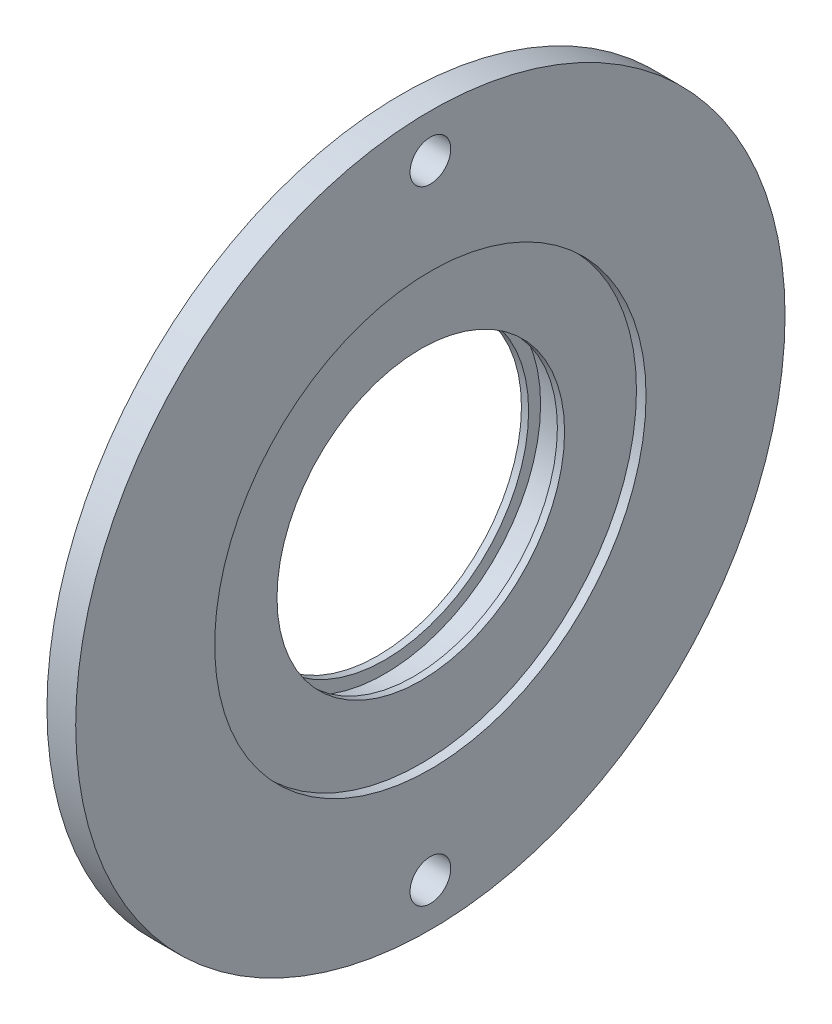
from build123d import *

# Parameters (mm, degrees)
ENL_V_MAT_EXTRU_1_DEPTH      = 211.456646367
ENL_V_MAT_EXTRU_1_DEPTH_BACK = 211.456646367
ESQUISSE2_R                  = 8.5
ESQUISSE3_R                  = 90
ENL_V_MAT_EXTRU_2_DEPTH      = 4
ENL_V_START                  = -3
ESQUISSE6_R                  = 65
ENL_V_MAT_EXTRU_5_DEPTH      = 12
ENL_V_MAT_EXTRU_6_DEPTH      = 211.456646367
ENL_V_MAT_EXTRU_6_DEPTH_BACK = 211.456646367
ESQUISSE7_R                  = 60


with BuildPart() as part:
    # Esquisse1 → Révolution1 (revolve)
    with BuildSketch(Plane.XY, mode=Mode.PRIVATE) as r_volution1_sk:
        Polygon((22, 0), (0, 0), (0, 100), (10, 100), (10, 148), (22, 148), align=None)
    revolve(r_volution1_sk.sketch.rotate(Axis((22, 0, 0), (-1, 0, 0)), 90), axis=Axis((22, 0, 0), (-1, 0, 0)))

    # Esquisse2 → Enlèv. mat.-Extru.1 (cut, two sides: drawn at the far end of the back side and taken through both)
    with BuildSketch(Plane(origin=(22, 0, 0), x_dir=(0, 0, -1), z_dir=(1, 0, 0)).offset(-ENL_V_MAT_EXTRU_1_DEPTH_BACK)):
        with Locations((0, 130)):
            Circle(ESQUISSE2_R)
        with Locations((0, -130)):
            Circle(ESQUISSE2_R)
    extrude(amount=ENL_V_MAT_EXTRU_1_DEPTH + ENL_V_MAT_EXTRU_1_DEPTH_BACK, mode=Mode.SUBTRACT)

    # Esquisse3 → Enlèv. mat.-Extru.2 (cut)
    with BuildSketch(Plane(origin=(22, 0, 0), x_dir=(0, 0, -1), z_dir=(1, 0, 0))):
        Circle(ESQUISSE3_R)
    extrude(amount=-ENL_V_MAT_EXTRU_2_DEPTH, mode=Mode.SUBTRACT)

    # Esquisse6 → Enlèv. mat.-Extru.5 (cut)
    with BuildSketch(Plane(origin=(18, 0, 0), x_dir=(0, 0, -1), z_dir=(1, 0, 0)).offset(ENL_V_START)):
        Circle(ESQUISSE6_R)
    extrude(amount=-ENL_V_MAT_EXTRU_5_DEPTH, mode=Mode.SUBTRACT)

    # Esquisse7 → Enlèv. mat.-Extru.6 (cut, two sides: drawn at the far end of the back side and taken through both)
    with BuildSketch(Plane(origin=(22, 0, 0), x_dir=(0, 0, -1), z_dir=(1, 0, 0)).offset(-ENL_V_MAT_EXTRU_6_DEPTH_BACK)):
        Circle(ESQUISSE7_R)
    extrude(amount=ENL_V_MAT_EXTRU_6_DEPTH + ENL_V_MAT_EXTRU_6_DEPTH_BACK, mode=Mode.SUBTRACT)


solid = part.part
